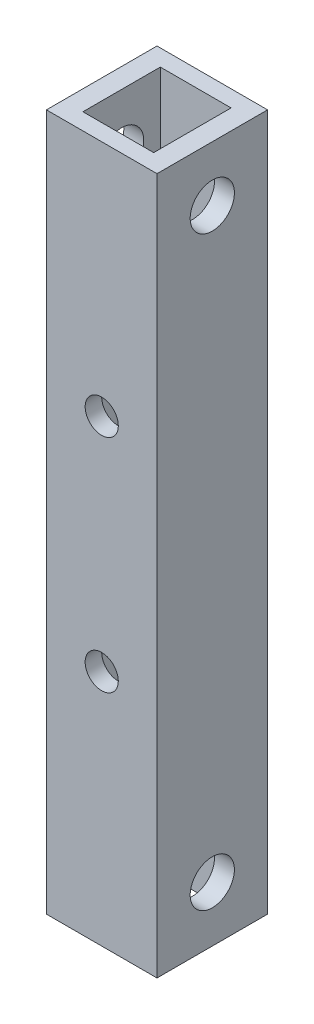
from build123d import *

# Parameters (mm, degrees)
SKETCH_1_W          = 10
SKETCH_1_H          = 10
SKETCH_1_W_2        = 6.4
SKETCH_1_H_2        = 7
EXTRUDE_1_DEPTH     = 63
SKETCH_2_R          = 1.5
CUT_EXTRUDE_1_DEPTH = 30
SKETCH_3_R          = 2
CUT_EXTRUDE_2_DEPTH = 30


with BuildPart() as part:
    # 草图1 → 凸台-拉伸1 (new body)
    with BuildSketch(Plane(origin=(0, 0, 0), x_dir=(1, 0, 0), z_dir=(0, 1, 0))):
        Rectangle(SKETCH_1_W, SKETCH_1_H)
        Rectangle(SKETCH_1_W_2, SKETCH_1_H_2, mode=Mode.SUBTRACT)
    extrude(amount=EXTRUDE_1_DEPTH)

    # 草图2 → 切除-拉伸1 (cut)
    with BuildSketch(Plane.XY.offset(5)):
        with Locations((0, 41.5)):
            Circle(SKETCH_2_R)
        with Locations((0, 21.5)):
            Circle(SKETCH_2_R)
    extrude(amount=-CUT_EXTRUDE_1_DEPTH, mode=Mode.SUBTRACT)

    # 草图3 → 切除-拉伸2 (cut)
    with BuildSketch(Plane(origin=(5, 0, 0), x_dir=(0, 0, -1), z_dir=(1, 0, 0))):
        with Locations((0, 5)):
            Circle(SKETCH_3_R)
        with Locations((0, 58)):
            Circle(SKETCH_3_R)
    extrude(amount=-CUT_EXTRUDE_2_DEPTH, mode=Mode.SUBTRACT)


solid = part.part
